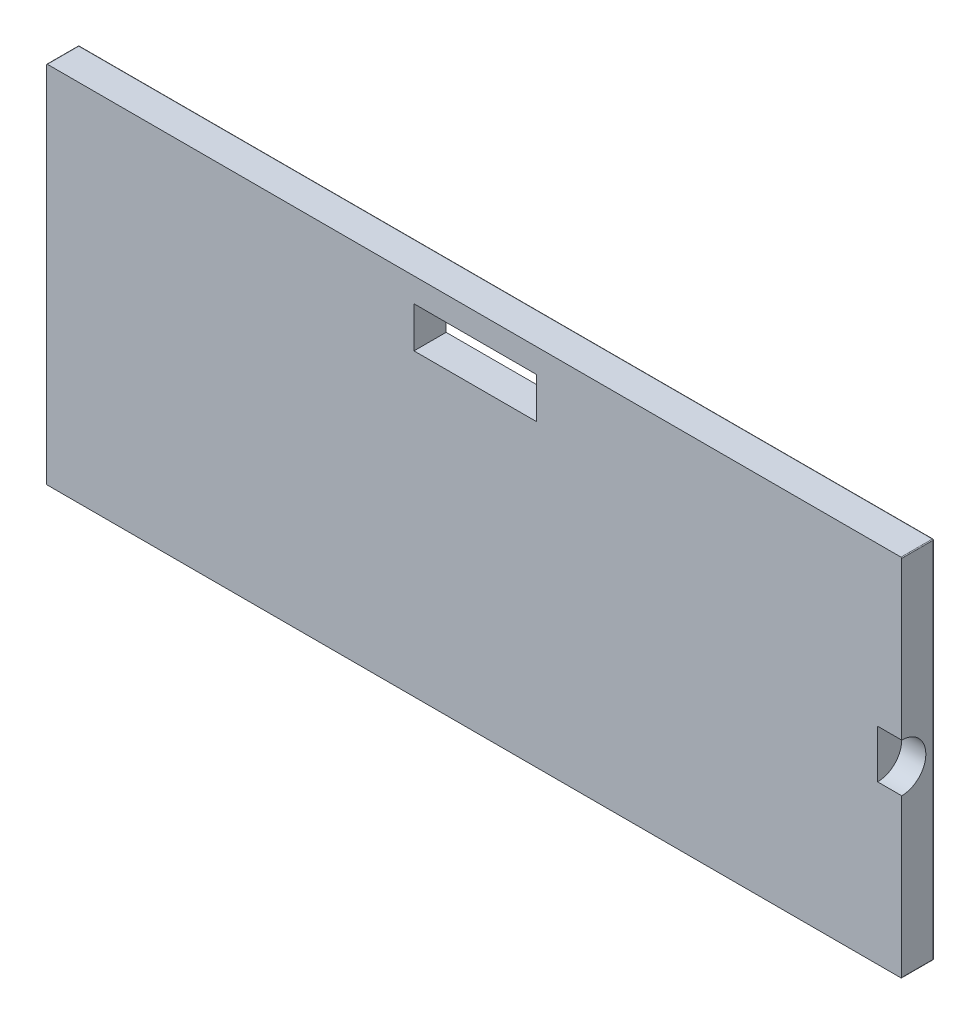
from build123d import *

# Parameters (mm, degrees)
BOSS_EXTRUDE1_DEPTH      = 76.2
BOSS_EXTRUDE1_DEPTH_BACK = 25.4
SKETCH1_W                = 2704.084
SKETCH1_H                = 1152.398
SKETCH1_W_2              = 387.096
SKETCH1_H_2              = 129.032
SKETCH2_R                = 76.2
CUT_EXTRUDE1_DEPTH       = 76.2
FILLET1_R                = 2.54


with BuildPart() as part:
    # Sketch1 → Boss-Extrude1 (new, two sides: drawn at the far end of the back side and taken through both)
    with BuildSketch(Plane.XY.offset(-BOSS_EXTRUDE1_DEPTH_BACK)):
        with Locations((1352.042, 576.199)):
            Rectangle(SKETCH1_W, SKETCH1_H)
        with Locations((1355.344, 1011.682)):
            Rectangle(SKETCH1_W_2, SKETCH1_H_2, mode=Mode.SUBTRACT)
    extrude(amount=BOSS_EXTRUDE1_DEPTH + BOSS_EXTRUDE1_DEPTH_BACK)

    # Sketch2 → Cut-Extrude1 (cut)
    with BuildSketch(Plane(origin=(2704.084, 0, 0), x_dir=(0, 0, -1), z_dir=(1, 0, 0))):
        with Locations((-76.2, 576.199)):
            Circle(SKETCH2_R)
    extrude(amount=-CUT_EXTRUDE1_DEPTH, mode=Mode.SUBTRACT)

    # Fillet1
    fillet1_edges = [part.edges().sort_by_distance(p)[0] for p in [
        (2704.084, 576.199, -25.4),
        (1352.042, 1152.398, -25.4),
        (0, 576.199, -25.4),
        (0, 1152.398, 25.4),
        (2704.084, 1152.398, 25.4),
        (2704.084, 0, 25.4),
        (0, 0, 25.4),
        (1352.042, 0, -25.4),
    ]]
    fillet(fillet1_edges, radius=FILLET1_R)


solid = part.part
